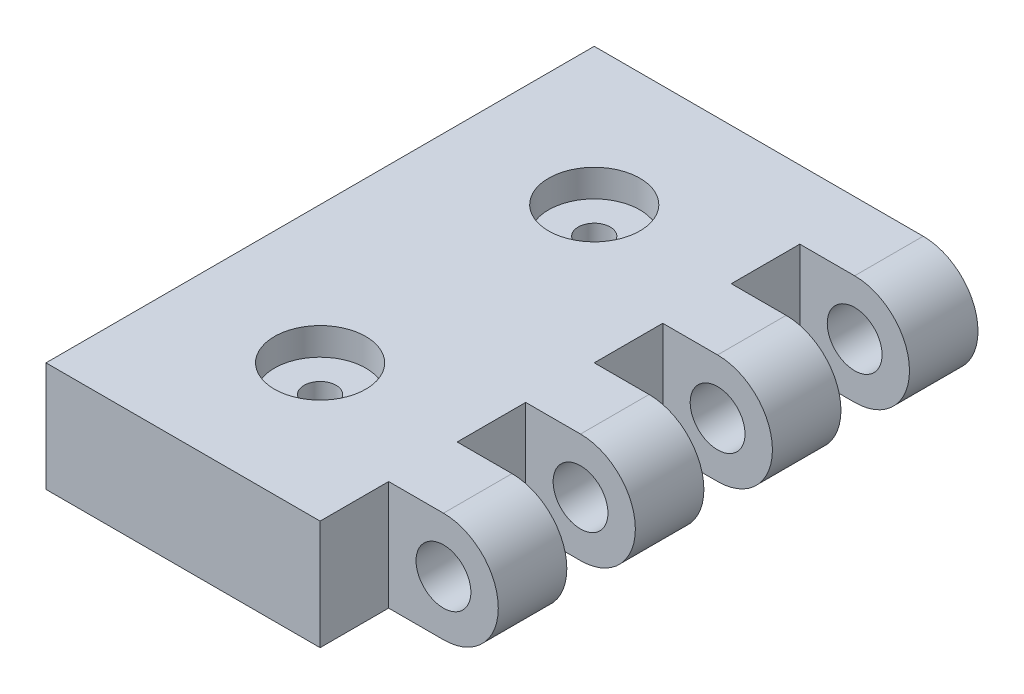
from build123d import *

# Parameters (mm, degrees)
SKETCH1_W           = 30
SKETCH1_H           = 60
BOSS_EXTRUDE1_DEPTH = 12
SKETCH2_R           = 3
BOSS_EXTRUDE2_DEPTH = 60
SKETCH3_W           = 12
SKETCH3_H           = 7.5
CUT_EXTRUDE1_DEPTH  = 69.14690015
LPATTERN1_COUNT     = 4
LPATTERN1_PITCH     = 15
SKETCH4_R           = 1.75
CUT_EXTRUDE2_DEPTH  = 69.14690015
SKETCH5_R           = 5
CUT_EXTRUDE3_DEPTH  = 3
LPATTERN2_COUNT     = 2
LPATTERN2_PITCH     = 9


with BuildPart() as part:
    # Sketch1 → Boss-Extrude1 (new body)
    with BuildSketch(Plane(origin=(0, 0, 0), x_dir=(1, 0, 0), z_dir=(0, 1, 0))):
        with Locations((-15, 30)):
            Rectangle(SKETCH1_W, SKETCH1_H)
    extrude(amount=BOSS_EXTRUDE1_DEPTH)

    # Sketch2 → Boss-Extrude2 (add)
    with BuildSketch(Plane.XY):
        with BuildLine():
            Line((0, 6), (0, 0))
            Line((0, 0), (6, 0))
            ThreePointArc((6, 0), (12, 6), (6, 12))
            Line((6, 12), (0, 12))
            Line((0, 12), (0, 6))
        make_face()
        with Locations((6, 6)):
            Circle(SKETCH2_R, mode=Mode.SUBTRACT)
    extrude(amount=-BOSS_EXTRUDE2_DEPTH)

    # Sketch3 → Cut-Extrude1 (cut, through all)
    with BuildSketch(Plane(origin=(0, 12, 0), x_dir=(1, 0, 0), z_dir=(0, 1, 0))):
        with Locations((6, 48.75)):
            Rectangle(SKETCH3_W, SKETCH3_H)
    cut_extrude1 = extrude(amount=-CUT_EXTRUDE1_DEPTH, mode=Mode.SUBTRACT)

    # LPattern1: Cut-Extrude1 ×4
    with Locations(*[(0, 0, i * LPATTERN1_PITCH) for i in range(1, LPATTERN1_COUNT)]):
        add(cut_extrude1, mode=Mode.SUBTRACT)

    # Sketch4 → Cut-Extrude2 (cut, through all)
    with BuildSketch(Plane(origin=(0, 12, 0), x_dir=(1, 0, 0), z_dir=(0, 1, 0))):
        with Locations(Location((-15, 45, 0), (0, 0, 270))):
            Circle(SKETCH4_R)
        with Locations(Location((-15, 15, 0), (0, 0, 270))):
            Circle(SKETCH4_R)
    extrude(amount=-CUT_EXTRUDE2_DEPTH, mode=Mode.SUBTRACT)

    # Sketch5 → Cut-Extrude3 (cut)
    with BuildSketch(Plane(origin=(0, 12, 0), x_dir=(1, 0, 0), z_dir=(0, 1, 0))):
        with Locations(Location((-15, 45, 0), (0, 0, 270))):
            Circle(SKETCH5_R)
        with Locations(Location((-15, 15, 0), (0, 0, 270))):
            Circle(SKETCH5_R)
    cut_extrude3 = extrude(amount=-CUT_EXTRUDE3_DEPTH, mode=Mode.SUBTRACT)

    # LPattern2: Cut-Extrude3 ×2
    with Locations(*[(0, -i * LPATTERN2_PITCH, 0) for i in range(1, LPATTERN2_COUNT)]):
        add(cut_extrude3, mode=Mode.SUBTRACT)


solid = part.part
